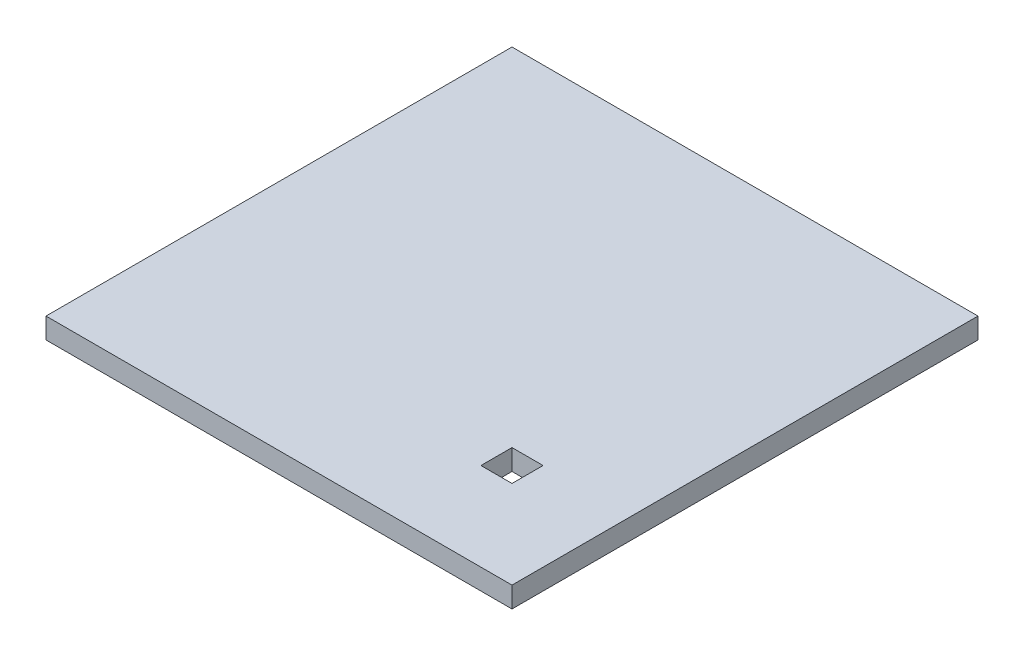
from build123d import *

# Parameters (mm, degrees)
CROQUIS1_W              = 45
CROQUIS1_H              = 45
SALIENTE_EXTRUIR1_DEPTH = 2
CROQUIS2_W              = 3
CROQUIS2_H              = 3
CORTAR_EXTRUIR1_DEPTH   = 5


with BuildPart() as part:
    # Croquis1 → Saliente-Extruir1 (new body)
    with BuildSketch(Plane(origin=(0, 0, 0), x_dir=(1, 0, 0), z_dir=(0, 1, 0))):
        with Locations((22.5, 22.5)):
            Rectangle(CROQUIS1_W, CROQUIS1_H)
    extrude(amount=SALIENTE_EXTRUIR1_DEPTH)

    # Croquis2 → Cortar-Extruir1 (cut)
    with BuildSketch(Plane(origin=(0, 2, 0), x_dir=(1, 0, 0), z_dir=(0, 1, 0))):
        with Locations((35, 10)):
            Rectangle(CROQUIS2_W, CROQUIS2_H)
    extrude(amount=-CORTAR_EXTRUIR1_DEPTH, mode=Mode.SUBTRACT)


solid = part.part
